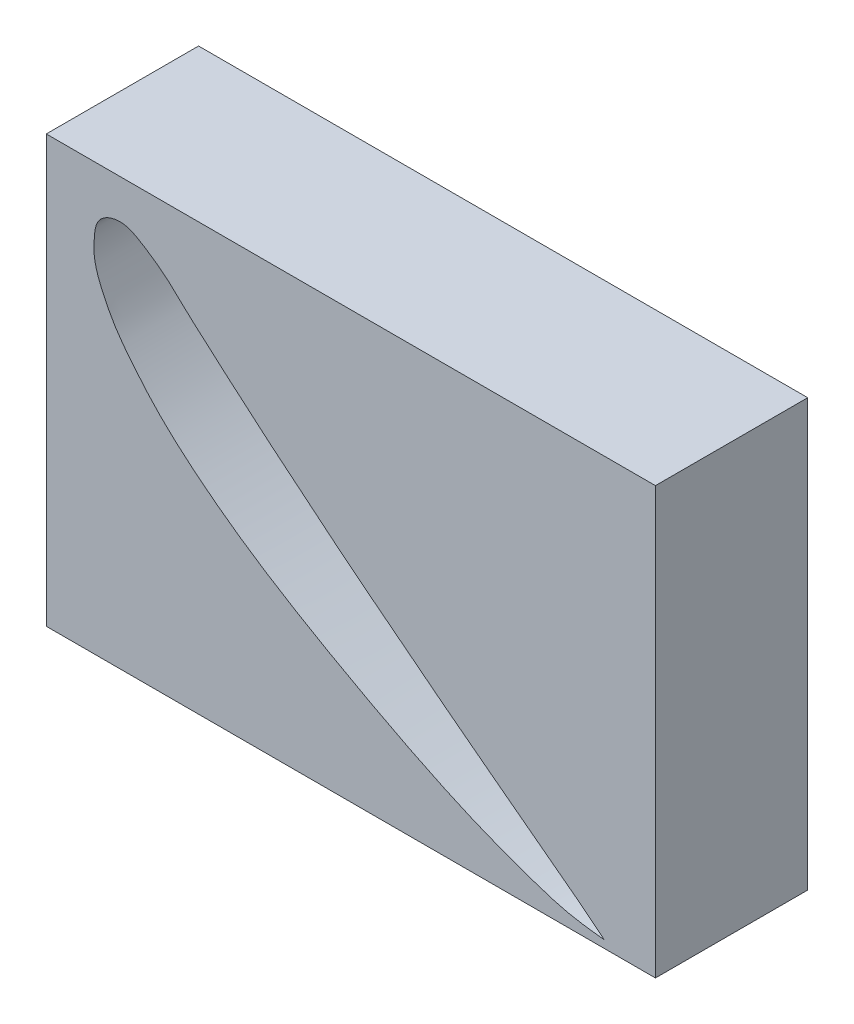
from build123d import *

# Parameters (mm, degrees)
SKICA3_W                 = 100
SKICA3_H                 = 70
P_IDAT_VYSUNUT_M1_DEPTH  = 25
ODEBRAT_VYSUNUT_M1_DEPTH = 85.409715081


with BuildPart() as part:
    # Skica3 → Přidat vysunutím1 (new body)
    with BuildSketch(Plane.XY.offset(-25)):
        with Locations((20, -5)):
            Rectangle(SKICA3_W, SKICA3_H)
    extrude(amount=P_IDAT_VYSUNUT_M1_DEPTH)

    # Skica1 → Odebrat vysunutím1 (cut, through all)
    with BuildSketch(Plane.XY):
        with BuildLine():
            Line((57.603675006, -35.542429999), (61.601004522, -38.767559005))
            add(Edge.make_bspline(
                [(57.603675006, -35.542429999), (56.238897792, -34.507468829), (52.144566151, -31.40258532), (45.330758501, -26.214738829), (37.106732423, -20.052607104), (29.060936616, -13.661738815), (20.916906734, -7.397980405), (12.993032352, -0.858716209), (5.05828581, 5.670386092), (-1.379948759, 11.318607109), (-6.554091766, 15.8203852), (-9.572378051, 18.8722758), (-12.298789196, 20.976651583), (-14.463551955, 22.392617727), (-16.510186542, 23.517460462), (-19.035080799, 23.66547359), (-21.8604449, 22.339635175), (-22.134910017, 19.281593231), (-22.237177343, 16.518515343), (-21.527333861, 13.835354833), (-20.284539721, 11.135740761), (-18.579865178, 7.879095762), (-15.850843977, 4.352029846), (-11.347414771, -0.934034013), (-4.870295535, -6.644525997), (3.449175116, -12.737304019), (12.262955505, -18.1725092), (21.328598188, -23.293085236), (30.618221962, -28.171368997), (40.240549073, -32.708260626), (48.664065782, -35.853082064), (55.790549096, -38.110896555), (59.620813711, -38.543769843), (61.601004522, -38.767559005)],
                knots=[0, 0, 0, 0, 0.024539223, 0.07361767, 0.122696116, 0.171758102, 0.220820089, 0.269879113, 0.318936693, 0.368025362, 0.392583028, 0.417173001, 0.429440473, 0.441764659, 0.454461371, 0.461994016, 0.477712657, 0.492780517, 0.502278123, 0.517831839, 0.53165607, 0.54495703, 0.570361211, 0.595284184, 0.644429949, 0.693535769, 0.742943263, 0.792666042, 0.842690658, 0.893260266, 0.944915782, 0.971522264, 1, 1, 1, 1], degree=3))
        make_face()
    extrude(amount=-ODEBRAT_VYSUNUT_M1_DEPTH, mode=Mode.SUBTRACT)


solid = part.part
